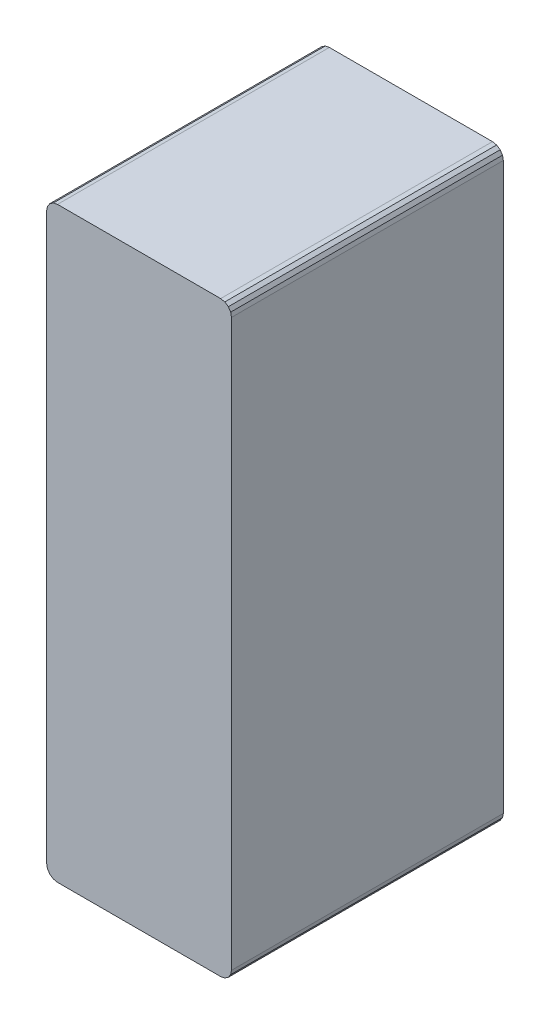
from build123d import *

# Parameters (mm, degrees)
EXTRUDE_B01_DEPTH = 50


with BuildPart() as part:
    # S01_圆角包络轮廓 → B01_圆角包络轮廓 (new body)
    with BuildSketch(Plane.XY):
        Polygon((17, 52), (16.847759065, 52.765366865), (16.414213562, 53.414213562), (15.765366865, 53.847759065), (15, 54), (-15, 54), (-15.765366865, 53.847759065), (-16.414213562, 53.414213562), (-16.847759065, 52.765366865), (-17, 52), (-17, -52), (-16.847759065, -52.765366865), (-16.414213562, -53.414213562), (-15.765366865, -53.847759065), (-15, -54), (15, -54), (15.765366865, -53.847759065), (16.414213562, -53.414213562), (16.847759065, -52.765366865), (17, -52), align=None)
    extrude(amount=EXTRUDE_B01_DEPTH)


solid = part.part
